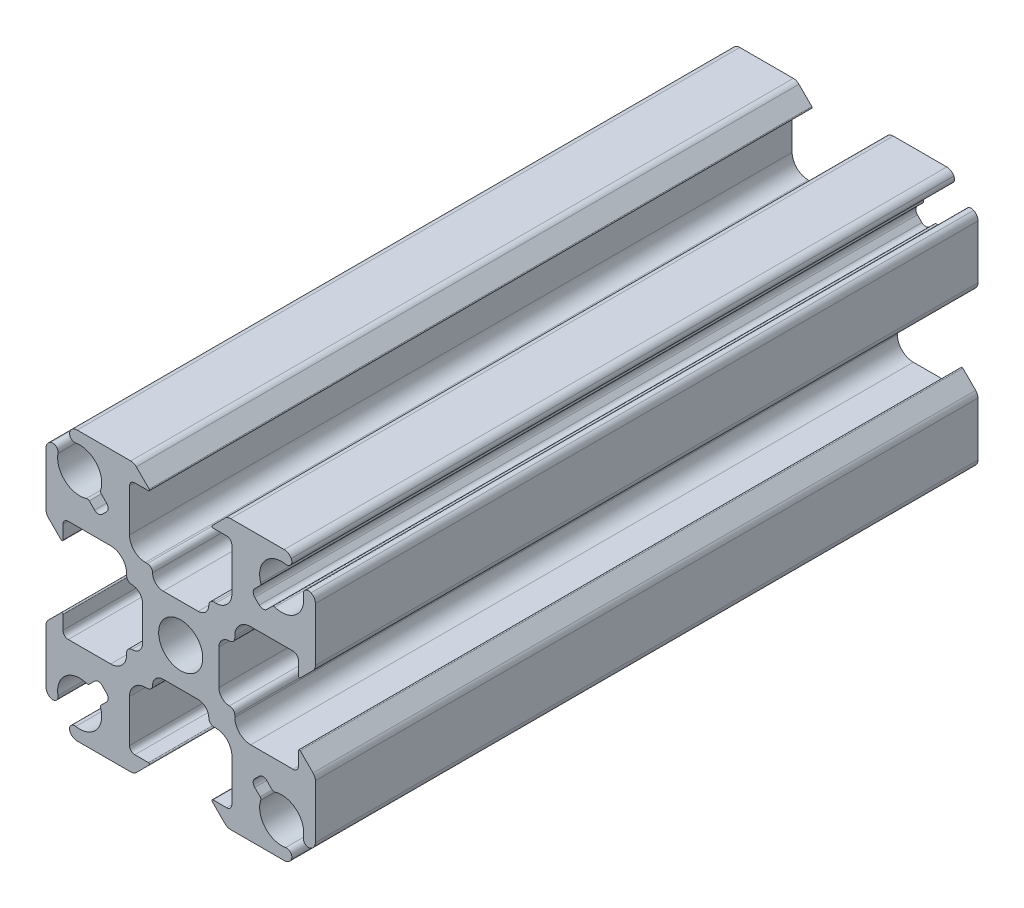
from build123d import *

# Parameters (mm, degrees)
SKETCH1_R           = 2.08
BOSS_EXTRUDE1_DEPTH = 31.241494032


with BuildPart() as part:
    # Sketch1 → Boss-Extrude1 (new, symmetric)
    with BuildSketch(Plane(origin=(0, 0, 0), x_dir=(-1, 0, 0), z_dir=(0, 0, -1))):
        with BuildLine():
            Line((-7.48853247, 8.61990332), (-6.985643798, 8.117014648))
            ThreePointArc((-6.985643798, 8.117014648), (-6.839197188, 7.763461257), (-6.985643798, 7.409907866))
            Line((-6.985643798, 7.409907866), (-7.409907866, 6.985643798))
            ThreePointArc((-7.409907866, 6.985643798), (-7.763461257, 6.839197188), (-8.117014648, 6.985643798))
            Line((-8.117014648, 6.985643798), (-8.61990332, 7.48853247))
            ThreePointArc((-8.61990332, 7.48853247), (-8.738774884, 7.554957329), (-8.874825936, 7.549228331))
            ThreePointArc((-8.874825936, 7.549228331), (-10.889377278, 7.955008076), (-11.572136222, 9.893284252))
            ThreePointArc((-11.572136222, 9.893284252), (-11.766795458, 10.383720777), (-12.292708824, 10.42656157))
            ThreePointArc((-12.292708824, 10.42656157), (-12.590129525, 10.150252615), (-12.7, 9.759440396))
            Line((-12.7, 9.759440396), (-12.7, 4.710660172))
            ThreePointArc((-12.7, 4.710660172), (-12.642909649, 4.423647598), (-12.480330086, 4.180330086))
            Line((-12.480330086, 4.180330086), (-11.270710678, 2.970710678))
            ThreePointArc((-11.270710678, 2.970710678), (-11.161731657, 2.949033403), (-11.1, 3.041421356))
            Line((-11.1, 3.041421356), (-11.1, 4.325))
            ThreePointArc((-11.1, 4.325), (-10.953553391, 4.678553391), (-10.6, 4.825))
            Line((-10.6, 4.825), (-6.6, 4.825))
            ThreePointArc((-6.6, 4.825), (-5.539339828, 4.385660172), (-5.1, 3.325))
            Line((-5.1, 3.325), (-5.1, 3.15))
            ThreePointArc((-5.1, 3.15), (-4.953553391, 2.796446609), (-4.6, 2.65))
            ThreePointArc((-4.6, 2.65), (-3.892893219, 2.357106781), (-3.6, 1.65))
            Line((-3.6, 1.65), (-3.6, -1.65))
            ThreePointArc((-3.6, -1.65), (-3.892893219, -2.357106781), (-4.6, -2.65))
            ThreePointArc((-4.6, -2.65), (-4.953553391, -2.796446609), (-5.1, -3.15))
            Line((-5.1, -3.15), (-5.1, -3.325))
            ThreePointArc((-5.1, -3.325), (-5.539339828, -4.385660172), (-6.6, -4.825))
            Line((-6.6, -4.825), (-10.6, -4.825))
            ThreePointArc((-10.6, -4.825), (-10.953553391, -4.678553391), (-11.1, -4.325))
            Line((-11.1, -4.325), (-11.1, -3.041421356))
            ThreePointArc((-11.1, -3.041421356), (-11.161731657, -2.949033403), (-11.270710678, -2.970710678))
            Line((-11.270710678, -2.970710678), (-12.480330086, -4.180330086))
            ThreePointArc((-12.480330086, -4.180330086), (-12.642909649, -4.423647598), (-12.7, -4.710660172))
            Line((-12.7, -4.710660172), (-12.7, -9.759440396))
            ThreePointArc((-12.7, -9.759440396), (-12.590129525, -10.150252615), (-12.292708824, -10.42656157))
            ThreePointArc((-12.292708824, -10.42656157), (-11.766795458, -10.383720777), (-11.572136222, -9.893284252))
            ThreePointArc((-11.572136222, -9.893284252), (-10.889377278, -7.955008076), (-8.874825936, -7.549228331))
            ThreePointArc((-8.874825936, -7.549228331), (-8.738774884, -7.554957329), (-8.61990332, -7.48853247))
            Line((-8.61990332, -7.48853247), (-8.117014648, -6.985643798))
            ThreePointArc((-8.117014648, -6.985643798), (-7.763461257, -6.839197188), (-7.409907866, -6.985643798))
            Line((-7.409907866, -6.985643798), (-6.985643798, -7.409907866))
            ThreePointArc((-6.985643798, -7.409907866), (-6.839197188, -7.763461257), (-6.985643798, -8.117014648))
            Line((-6.985643798, -8.117014648), (-7.48853247, -8.61990332))
            ThreePointArc((-7.48853247, -8.61990332), (-7.554957329, -8.738774884), (-7.549228331, -8.874825936))
            ThreePointArc((-7.549228331, -8.874825936), (-7.955008076, -10.889377278), (-9.893284252, -11.572136222))
            ThreePointArc((-9.893284252, -11.572136222), (-10.383720777, -11.766795458), (-10.42656157, -12.292708824))
            ThreePointArc((-10.42656157, -12.292708824), (-10.150252615, -12.590129525), (-9.759440396, -12.7))
            Line((-9.759440396, -12.7), (-4.710660172, -12.7))
            ThreePointArc((-4.710660172, -12.7), (-4.423647598, -12.642909649), (-4.180330086, -12.480330086))
            Line((-4.180330086, -12.480330086), (-2.970710678, -11.270710678))
            ThreePointArc((-2.970710678, -11.270710678), (-2.949033403, -11.161731657), (-3.041421356, -11.1))
            Line((-3.041421356, -11.1), (-4.325, -11.1))
            ThreePointArc((-4.325, -11.1), (-4.678553391, -10.953553391), (-4.825, -10.6))
            Line((-4.825, -10.6), (-4.825, -6.6))
            ThreePointArc((-4.825, -6.6), (-4.385660172, -5.539339828), (-3.325, -5.1))
            Line((-3.325, -5.1), (-3.15, -5.1))
            ThreePointArc((-3.15, -5.1), (-2.796446609, -4.953553391), (-2.65, -4.6))
            ThreePointArc((-2.65, -4.6), (-2.357106781, -3.892893219), (-1.65, -3.6))
            Line((-1.65, -3.6), (1.65, -3.6))
            ThreePointArc((1.65, -3.6), (2.357106781, -3.892893219), (2.65, -4.6))
            ThreePointArc((2.65, -4.6), (2.796446609, -4.953553391), (3.15, -5.1))
            Line((3.15, -5.1), (3.325, -5.1))
            ThreePointArc((3.325, -5.1), (4.385660172, -5.539339828), (4.825, -6.6))
            Line((4.825, -6.6), (4.825, -10.6))
            ThreePointArc((4.825, -10.6), (4.678553391, -10.953553391), (4.325, -11.1))
            Line((4.325, -11.1), (3.041421356, -11.1))
            ThreePointArc((3.041421356, -11.1), (2.949033403, -11.161731657), (2.970710678, -11.270710678))
            Line((2.970710678, -11.270710678), (4.180330086, -12.480330086))
            ThreePointArc((4.180330086, -12.480330086), (4.423647598, -12.642909649), (4.710660172, -12.7))
            Line((4.710660172, -12.7), (9.759440396, -12.7))
            ThreePointArc((9.759440396, -12.7), (10.150252615, -12.590129525), (10.42656157, -12.292708824))
            ThreePointArc((10.42656157, -12.292708824), (10.383720777, -11.766795458), (9.893284252, -11.572136222))
            ThreePointArc((9.893284252, -11.572136222), (7.955008076, -10.889377278), (7.549228331, -8.874825936))
            ThreePointArc((7.549228331, -8.874825936), (7.554957329, -8.738774884), (7.48853247, -8.61990332))
            Line((7.48853247, -8.61990332), (6.985643798, -8.117014648))
            ThreePointArc((6.985643798, -8.117014648), (6.839197188, -7.763461257), (6.985643798, -7.409907866))
            Line((6.985643798, -7.409907866), (7.409907866, -6.985643798))
            ThreePointArc((7.409907866, -6.985643798), (7.763461257, -6.839197188), (8.117014648, -6.985643798))
            Line((8.117014648, -6.985643798), (8.61990332, -7.48853247))
            ThreePointArc((8.61990332, -7.48853247), (8.738774884, -7.554957329), (8.874825936, -7.549228331))
            ThreePointArc((8.874825936, -7.549228331), (10.889377278, -7.955008076), (11.572136222, -9.893284252))
            ThreePointArc((11.572136222, -9.893284252), (11.766795458, -10.383720777), (12.292708824, -10.42656157))
            ThreePointArc((12.292708824, -10.42656157), (12.590129525, -10.150252615), (12.7, -9.759440396))
            Line((12.7, -9.759440396), (12.7, -4.710660172))
            ThreePointArc((12.7, -4.710660172), (12.642909649, -4.423647598), (12.480330086, -4.180330086))
            Line((12.480330086, -4.180330086), (11.270710678, -2.970710678))
            ThreePointArc((11.270710678, -2.970710678), (11.161731657, -2.949033403), (11.1, -3.041421356))
            Line((11.1, -3.041421356), (11.1, -4.325))
            ThreePointArc((11.1, -4.325), (10.953553391, -4.678553391), (10.6, -4.825))
            Line((10.6, -4.825), (6.6, -4.825))
            ThreePointArc((6.6, -4.825), (5.539339828, -4.385660172), (5.1, -3.325))
            Line((5.1, -3.325), (5.1, -3.15))
            ThreePointArc((5.1, -3.15), (4.953553391, -2.796446609), (4.6, -2.65))
            ThreePointArc((4.6, -2.65), (3.892893219, -2.357106781), (3.6, -1.65))
            Line((3.6, -1.65), (3.6, 1.65))
            ThreePointArc((3.6, 1.65), (3.892893219, 2.357106781), (4.6, 2.65))
            ThreePointArc((4.6, 2.65), (4.953553391, 2.796446609), (5.1, 3.15))
            Line((5.1, 3.15), (5.1, 3.325))
            ThreePointArc((5.1, 3.325), (5.539339828, 4.385660172), (6.6, 4.825))
            Line((6.6, 4.825), (10.6, 4.825))
            ThreePointArc((10.6, 4.825), (10.953553391, 4.678553391), (11.1, 4.325))
            Line((11.1, 4.325), (11.1, 3.041421356))
            ThreePointArc((11.1, 3.041421356), (11.161731657, 2.949033403), (11.270710678, 2.970710678))
            Line((11.270710678, 2.970710678), (12.480330086, 4.180330086))
            ThreePointArc((12.480330086, 4.180330086), (12.642909649, 4.423647598), (12.7, 4.710660172))
            Line((12.7, 4.710660172), (12.7, 9.759440396))
            ThreePointArc((12.7, 9.759440396), (12.590129525, 10.150252615), (12.292708824, 10.42656157))
            ThreePointArc((12.292708824, 10.42656157), (11.766795458, 10.383720777), (11.572136222, 9.893284252))
            ThreePointArc((11.572136222, 9.893284252), (10.889377278, 7.955008076), (8.874825936, 7.549228331))
            ThreePointArc((8.874825936, 7.549228331), (8.738774884, 7.554957329), (8.61990332, 7.48853247))
            Line((8.61990332, 7.48853247), (8.117014648, 6.985643798))
            ThreePointArc((8.117014648, 6.985643798), (7.763461257, 6.839197188), (7.409907866, 6.985643798))
            Line((7.409907866, 6.985643798), (6.985643798, 7.409907866))
            ThreePointArc((6.985643798, 7.409907866), (6.839197188, 7.763461257), (6.985643798, 8.117014648))
            Line((6.985643798, 8.117014648), (7.48853247, 8.61990332))
            ThreePointArc((7.48853247, 8.61990332), (7.554957329, 8.738774884), (7.549228331, 8.874825936))
            ThreePointArc((7.549228331, 8.874825936), (7.955008076, 10.889377278), (9.893284252, 11.572136222))
            ThreePointArc((9.893284252, 11.572136222), (10.383720777, 11.766795458), (10.42656157, 12.292708824))
            ThreePointArc((10.42656157, 12.292708824), (10.150252615, 12.590129525), (9.759440396, 12.7))
            Line((9.759440396, 12.7), (4.710660172, 12.7))
            ThreePointArc((4.710660172, 12.7), (4.423647598, 12.642909649), (4.180330086, 12.480330086))
            Line((4.180330086, 12.480330086), (2.970710678, 11.270710678))
            ThreePointArc((2.970710678, 11.270710678), (2.949033403, 11.161731657), (3.041421356, 11.1))
            Line((3.041421356, 11.1), (4.325, 11.1))
            ThreePointArc((4.325, 11.1), (4.678553391, 10.953553391), (4.825, 10.6))
            Line((4.825, 10.6), (4.825, 6.6))
            ThreePointArc((4.825, 6.6), (4.385660172, 5.539339828), (3.325, 5.1))
            Line((3.325, 5.1), (3.15, 5.1))
            ThreePointArc((3.15, 5.1), (2.796446609, 4.953553391), (2.65, 4.6))
            ThreePointArc((2.65, 4.6), (2.357106781, 3.892893219), (1.65, 3.6))
            Line((1.65, 3.6), (-1.65, 3.6))
            ThreePointArc((-1.65, 3.6), (-2.357106781, 3.892893219), (-2.65, 4.6))
            ThreePointArc((-2.65, 4.6), (-2.796446609, 4.953553391), (-3.15, 5.1))
            Line((-3.15, 5.1), (-3.325, 5.1))
            ThreePointArc((-3.325, 5.1), (-4.385660172, 5.539339828), (-4.825, 6.6))
            Line((-4.825, 6.6), (-4.825, 10.6))
            ThreePointArc((-4.825, 10.6), (-4.678553391, 10.953553391), (-4.325, 11.1))
            Line((-4.325, 11.1), (-3.041421356, 11.1))
            ThreePointArc((-3.041421356, 11.1), (-2.949033403, 11.161731657), (-2.970710678, 11.270710678))
            Line((-2.970710678, 11.270710678), (-4.180330086, 12.480330086))
            ThreePointArc((-4.180330086, 12.480330086), (-4.423647598, 12.642909649), (-4.710660172, 12.7))
            Line((-4.710660172, 12.7), (-9.759440396, 12.7))
            ThreePointArc((-9.759440396, 12.7), (-10.150252615, 12.590129525), (-10.42656157, 12.292708824))
            ThreePointArc((-10.42656157, 12.292708824), (-10.383720777, 11.766795458), (-9.893284252, 11.572136222))
            ThreePointArc((-9.893284252, 11.572136222), (-7.955008076, 10.889377278), (-7.549228331, 8.874825936))
            ThreePointArc((-7.549228331, 8.874825936), (-7.554957329, 8.738774884), (-7.48853247, 8.61990332))
        make_face()
        with Locations(Location((0, 0, 0), (0, 0, 180))):
            Circle(SKETCH1_R, mode=Mode.SUBTRACT)
    extrude(amount=BOSS_EXTRUDE1_DEPTH, both=True)


solid = part.part
